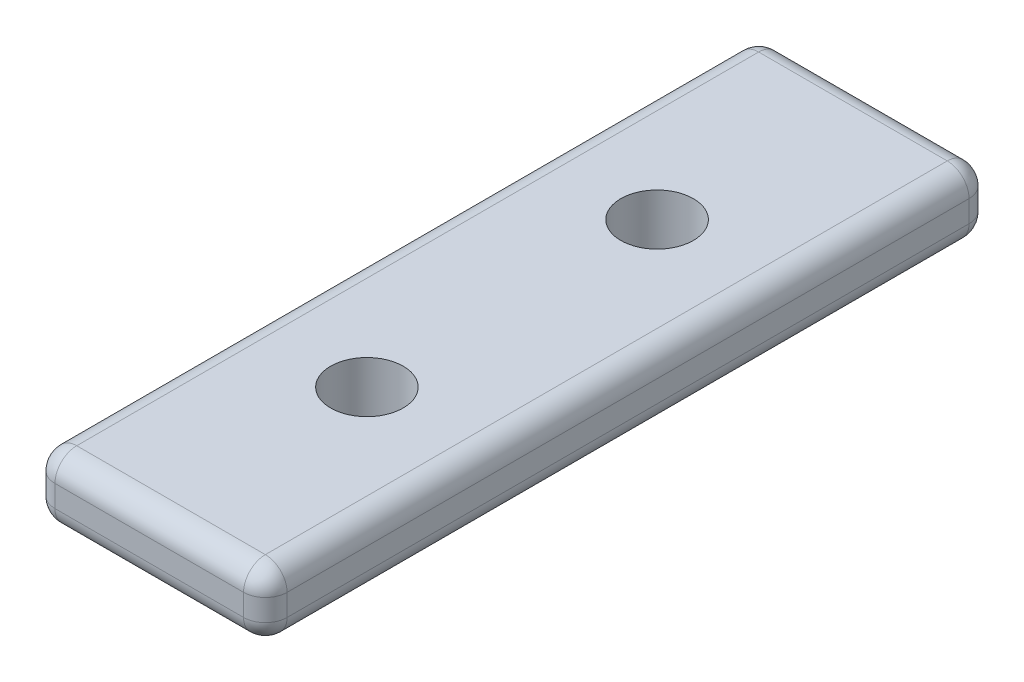
from build123d import *

# Parameters (mm, degrees)
SKETCH1_W           = 16
SKETCH1_H           = 4.5
BOSS_EXTRUDE1_DEPTH = 50
FILLET1_R           = 1.5
SKETCH2_R           = 2.5
CUT_EXTRUDE1_DEPTH  = 5


with BuildPart() as part:
    # Sketch1 → Boss-Extrude1 (new body)
    with BuildSketch(Plane.XY):
        Rectangle(SKETCH1_W, SKETCH1_H)
    extrude(amount=BOSS_EXTRUDE1_DEPTH)

    # Fillet1
    fillet1_edges = [part.edges().sort_by_distance(p)[0] for p in [
        (-8, 0, 50),
        (0, -2.25, 50),
        (8, 0, 50),
        (0, -2.25, 0),
        (-8, 0, 0),
        (0, 2.25, 0),
        (8, 0, 0),
        (0, 2.25, 50),
        (8, -2.25, 25),
        (-8, -2.25, 25),
        (-8, 2.25, 25),
        (8, 2.25, 25),
    ]]
    fillet(fillet1_edges, radius=FILLET1_R)

    # Sketch2 → Cut-Extrude1 (cut)
    with BuildSketch(Plane.XZ.offset(2.25)):
        with Locations(Location((0, 15, 0), (0, 0, 270))):
            Circle(SKETCH2_R)
        with Locations(Location((0, 35, 0), (0, 0, 270))):
            Circle(SKETCH2_R)
    extrude(amount=-CUT_EXTRUDE1_DEPTH, mode=Mode.SUBTRACT)


solid = part.part
